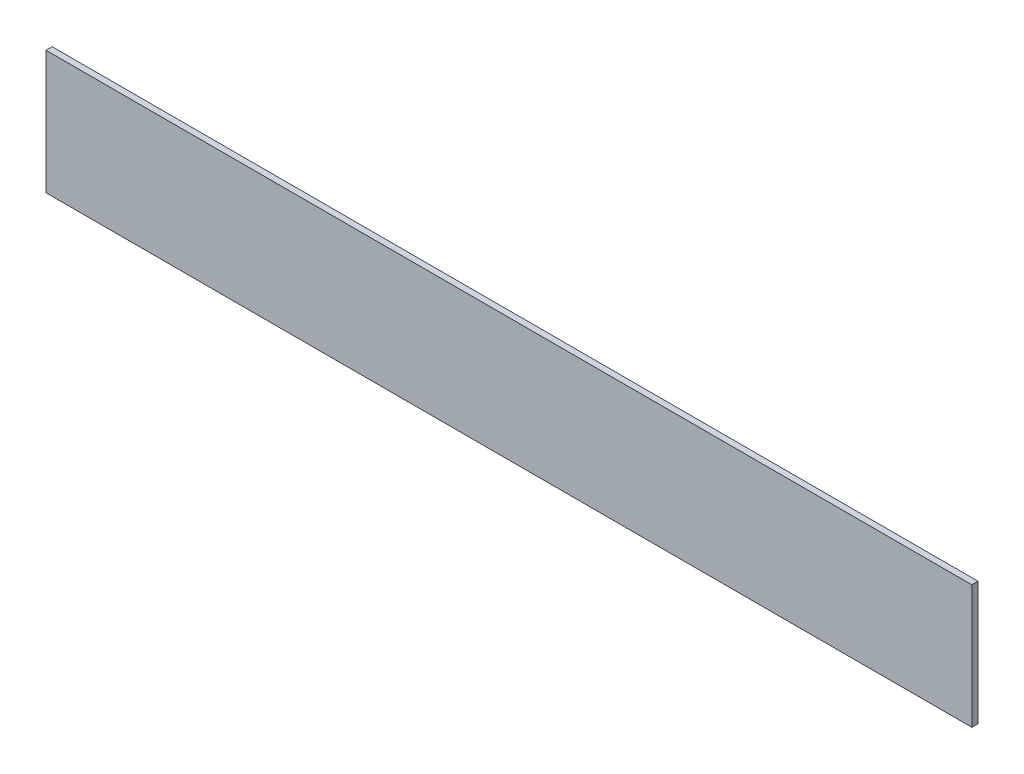
from build123d import *

# Parameters (mm, degrees)
EXTRUDE_1_DEPTH      = 1
EXTRUDE_1_DEPTH_BACK = 1
SKETCH_1_W           = 300
SKETCH_1_H           = 40


with BuildPart() as part:
    # ｽｹｯﾁ1 → ﾎﾞｽ - 押し出し1 (new, two sides: drawn at the far end of the back side and taken through both)
    with BuildSketch(Plane.XY.offset(-EXTRUDE_1_DEPTH_BACK)):
        Rectangle(SKETCH_1_W, SKETCH_1_H)
    extrude(amount=EXTRUDE_1_DEPTH + EXTRUDE_1_DEPTH_BACK)


solid = part.part
